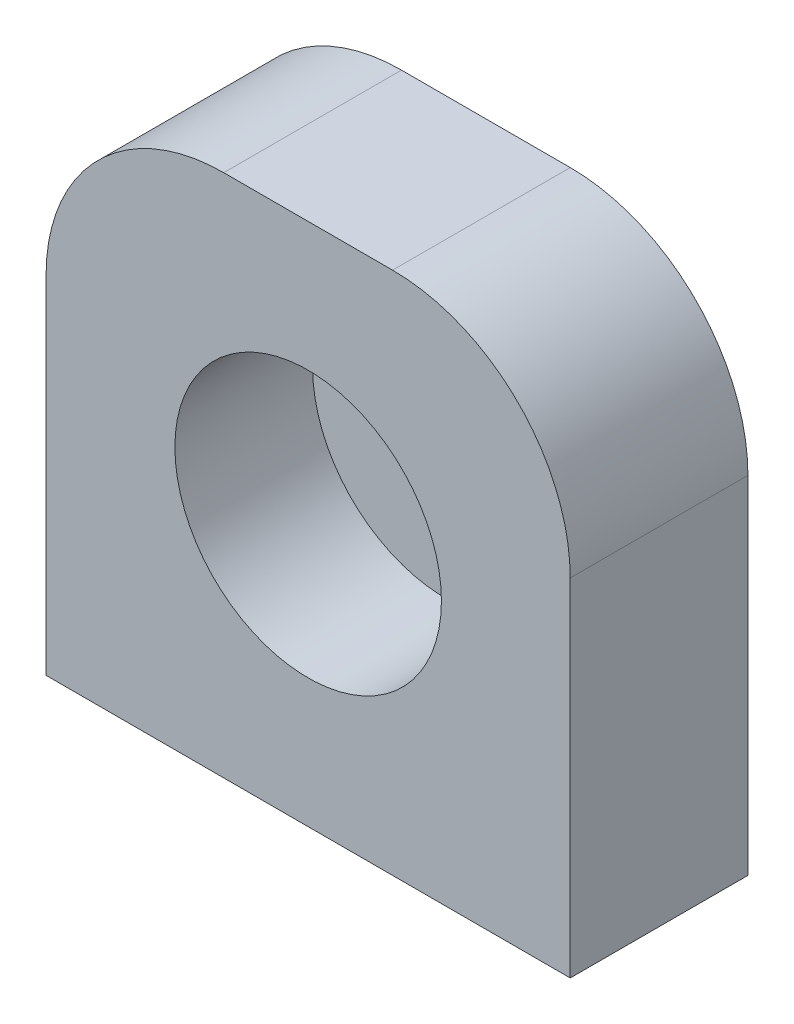
from build123d import *

# Parameters (mm, degrees)
SKETCH1_W           = 11.8
SKETCH1_H           = 11.8
BOSS_EXTRUDE1_DEPTH = 4
SKETCH2_R           = 3
CUT_EXTRUDE1_DEPTH  = 3.1
FILLET1_R           = 4


with BuildPart() as part:
    # Sketch1 → Boss-Extrude1 (new body)
    with BuildSketch(Plane.XY):
        with Locations((5.9, 5.9)):
            Rectangle(SKETCH1_W, SKETCH1_H)
    extrude(amount=BOSS_EXTRUDE1_DEPTH)

    # Sketch2 → Cut-Extrude1 (cut)
    with BuildSketch(Plane.XY.offset(4)):
        with Locations((5.9, 5.9)):
            Circle(SKETCH2_R)
    extrude(amount=-CUT_EXTRUDE1_DEPTH, mode=Mode.SUBTRACT)

    # Fillet1
    fillet1_edges = [part.edges().sort_by_distance(p)[0] for p in [
        (0, 11.8, 2),
        (11.8, 11.8, 2),
    ]]
    fillet(fillet1_edges, radius=FILLET1_R)


solid = part.part
